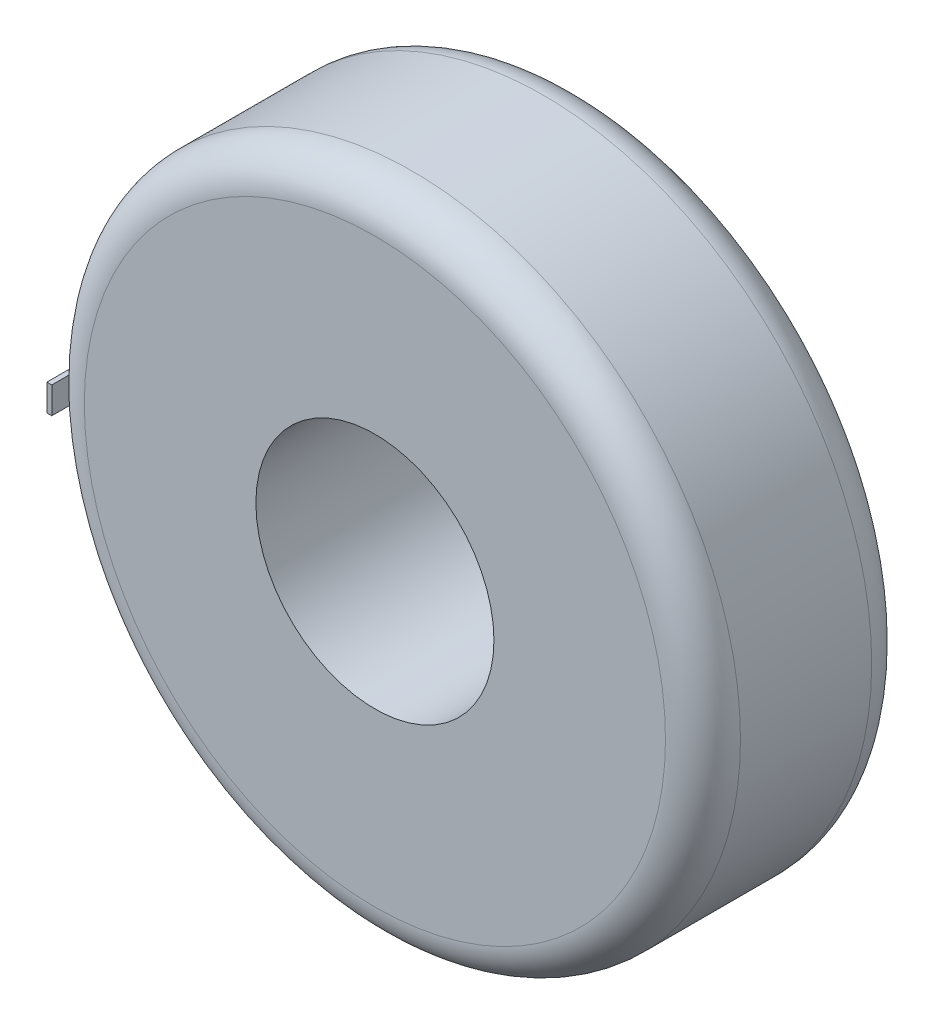
from build123d import *

# Parameters (mm, degrees)
CROQUIS1_R              = 17.5
CROQUIS1_R_2            = 6.35
SALIENTE_EXTRUIR1_DEPTH = 11
REDONDEO1_R             = 2
SALIENTE_EXTRUIR2_REACH = 29.083
CROQUIS2_W              = 0.263095083
CROQUIS2_H              = 1.425025485


with BuildPart() as part:
    # Croquis1 → Saliente-Extruir1 (new body)
    with BuildSketch(Plane.XY):
        Circle(CROQUIS1_R)
        Circle(CROQUIS1_R_2, mode=Mode.SUBTRACT)
    extrude(amount=SALIENTE_EXTRUIR1_DEPTH)

    # Redondeo1
    redondeo1_edges = [part.edges().sort_by_distance(p)[0] for p in [
        (-17.5, 0, 0),
        (-17.5, 0, 11),
    ]]
    fillet(redondeo1_edges, radius=REDONDEO1_R)

    # Saliente-Extruir2: up to this face of the body (flat: up to its plane)
    saliente_extruir2_end = Plane(part.part.faces().sort_by_distance((-15.061593796, 0, 0))[0])
    # Croquis2 → Saliente-Extruir2 (add, up to the picked face)
    with BuildSketch(Plane.XY.offset(11), mode=Mode.PRIVATE) as saliente_extruir2_sk1:
        with Locations((-17.368452459, -0.712512743)):
            Rectangle(CROQUIS2_W, CROQUIS2_H)
    saliente_extruir2_tool1 = split(extrude(saliente_extruir2_sk1.sketch, amount=-SALIENTE_EXTRUIR2_REACH, mode=Mode.PRIVATE), bisect_by=saliente_extruir2_end, keep=Keep.BOTH, mode=Mode.PRIVATE)
    add(saliente_extruir2_tool1.solids().sort_by(Axis((-17.368452, -0.712513, 11), (0, 0, -1)))[0])


solid = part.part
